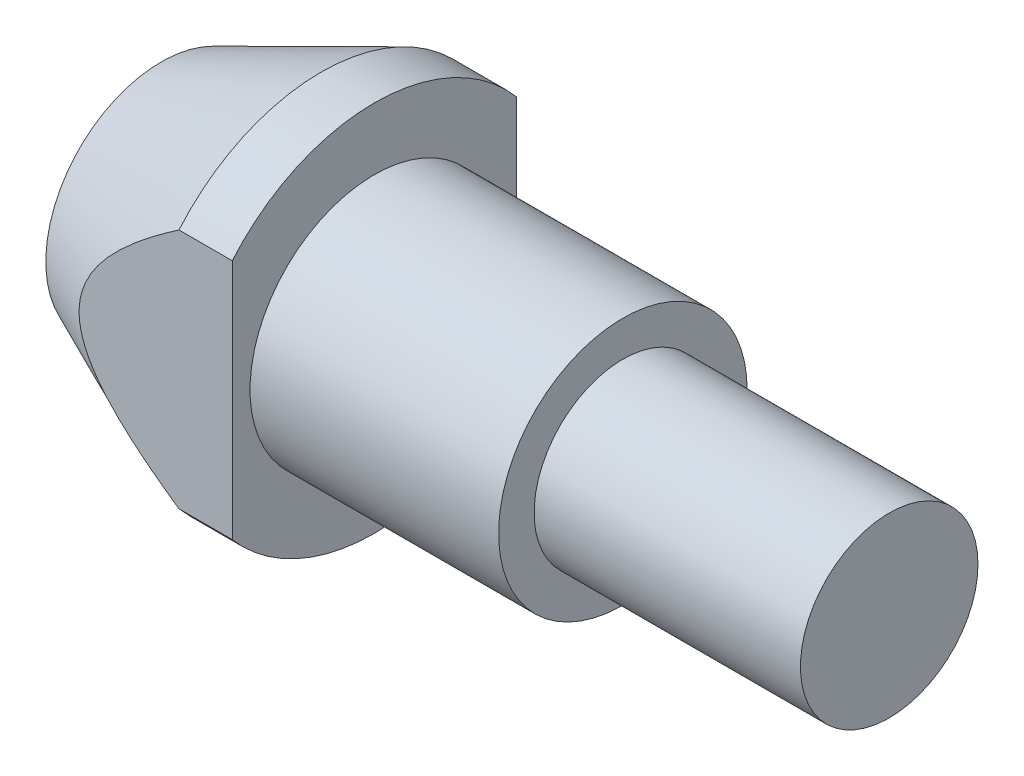
from build123d import *

# Parameters (mm, degrees)
SKETCH2_W          = 0.562344702
SKETCH2_H          = 2.292150926
CUT_EXTRUDE1_DEPTH = 5.137744978


with BuildPart() as part:
    # Sketch1 → Revolve1 (revolve)
    with BuildSketch(Plane.XY, mode=Mode.PRIVATE) as revolve1_sk:
        Polygon((-1.778, 0.889), (0, 0.889), (0, 0.635), (1.905, 0.635), (1.905, 0), (-3.302, 0), (-3.302, 0.8255), (-2.159, 1.3335), (-1.778, 1.3335), align=None)
    revolve(revolve1_sk.sketch.rotate(Axis((0, 0, 0), (-1, 0, 0)), 90), axis=Axis((0, 0, 0), (-1, 0, 0)))

    # Sketch2 → Cut-Extrude1 (cut, through all)
    with BuildSketch(Plane(origin=(-1.778, 0, 0), x_dir=(0, 0, -1), z_dir=(1, 0, 0))):
        with Locations((-1.297172351, -0.075001494)):
            Rectangle(SKETCH2_W, SKETCH2_H)
        with Locations((1.297172351, -0.075001494)):
            Rectangle(SKETCH2_W, SKETCH2_H)
    extrude(amount=-CUT_EXTRUDE1_DEPTH, mode=Mode.SUBTRACT)


solid = part.part
